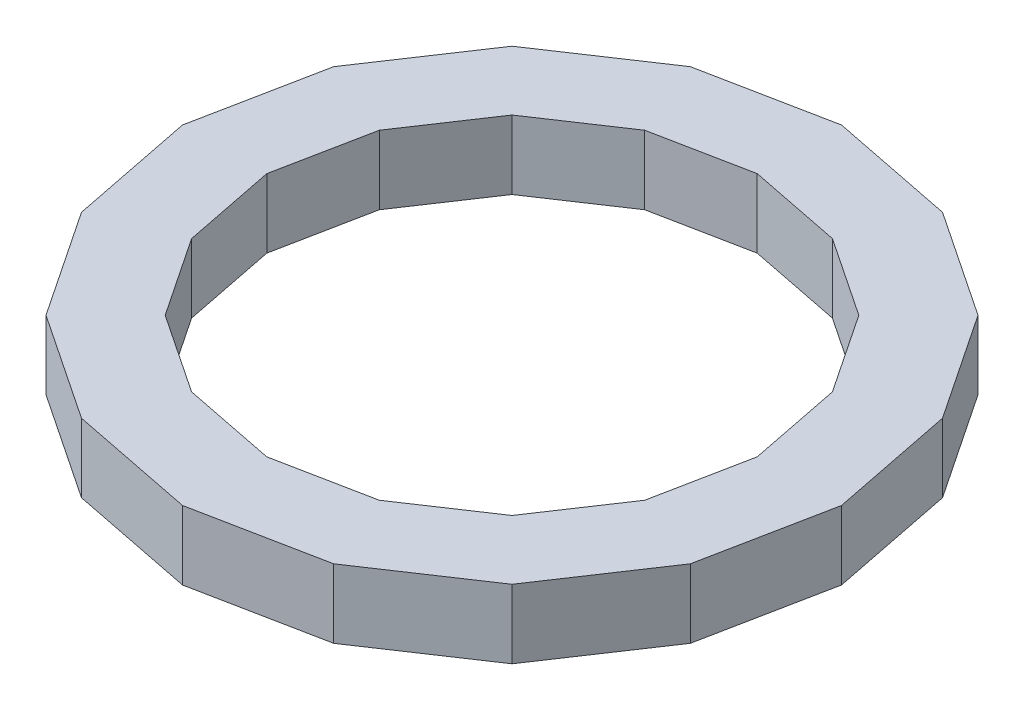
from build123d import *

# Parameters (mm, degrees)
BOSS_EXTRUDE1_DEPTH = 19.05


with BuildPart() as part:
    # Sketch1 → Boss-Extrude1 (new body)
    with BuildSketch(Plane(origin=(0, 0, 0), x_dir=(1, 0, 0), z_dir=(0, 1, 0))):
        Polygon((91.137273322, 0), (84.199861471, 34.876724571), (64.443783985, 64.443783985), (34.876724571, 84.199861471), (0, 91.137273322), (-34.876724571, 84.199861471), (-64.443783985, 64.443783985), (-84.199861471, 34.876724571), (-91.137273322, 0), (-84.199861471, -34.876724571), (-64.443783985, -64.443783985), (-34.876724571, -84.199861471), (0, -91.137273322), (34.876724571, -84.199861471), (64.443783985, -64.443783985), (84.199861471, -34.876724571), align=None)
        Polygon((67.829419445, 0), (62.666212327, 25.957195049), (47.962642454, 47.962642454), (25.957195049, 62.666212327), (0, 67.829419445), (-25.957195049, 62.666212327), (-47.962642454, 47.962642454), (-62.666212327, 25.957195049), (-67.829419445, 0), (-62.666212327, -25.957195049), (-47.962642454, -47.962642454), (-25.957195049, -62.666212327), (0, -67.829419445), (25.957195049, -62.666212327), (47.962642454, -47.962642454), (62.666212327, -25.957195049), align=None, mode=Mode.SUBTRACT)
    extrude(amount=BOSS_EXTRUDE1_DEPTH)


solid = part.part
